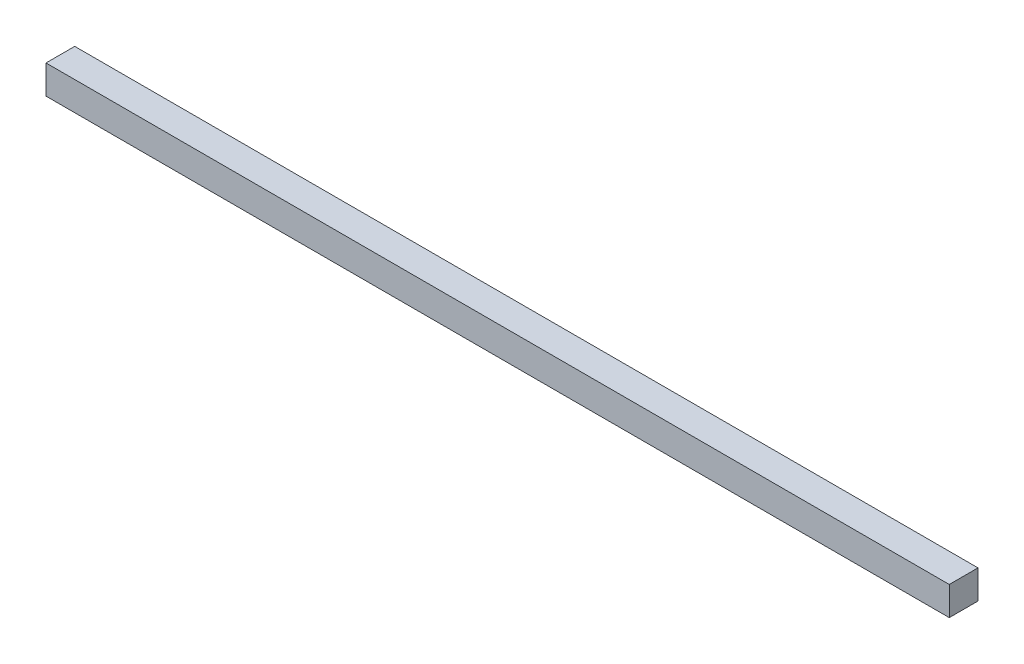
from build123d import *

# Parameters (mm, degrees)
SKETCH_1_W        = 2200
SKETCH_1_H        = 70
EXTRUDE_303_DEPTH = 70


with BuildPart() as part:
    # 草图1 → Extrude 303 (new body)
    with BuildSketch(Plane.XY):
        with Locations((1100, 35)):
            Rectangle(SKETCH_1_W, SKETCH_1_H)
    extrude(amount=EXTRUDE_303_DEPTH)


solid = part.part
